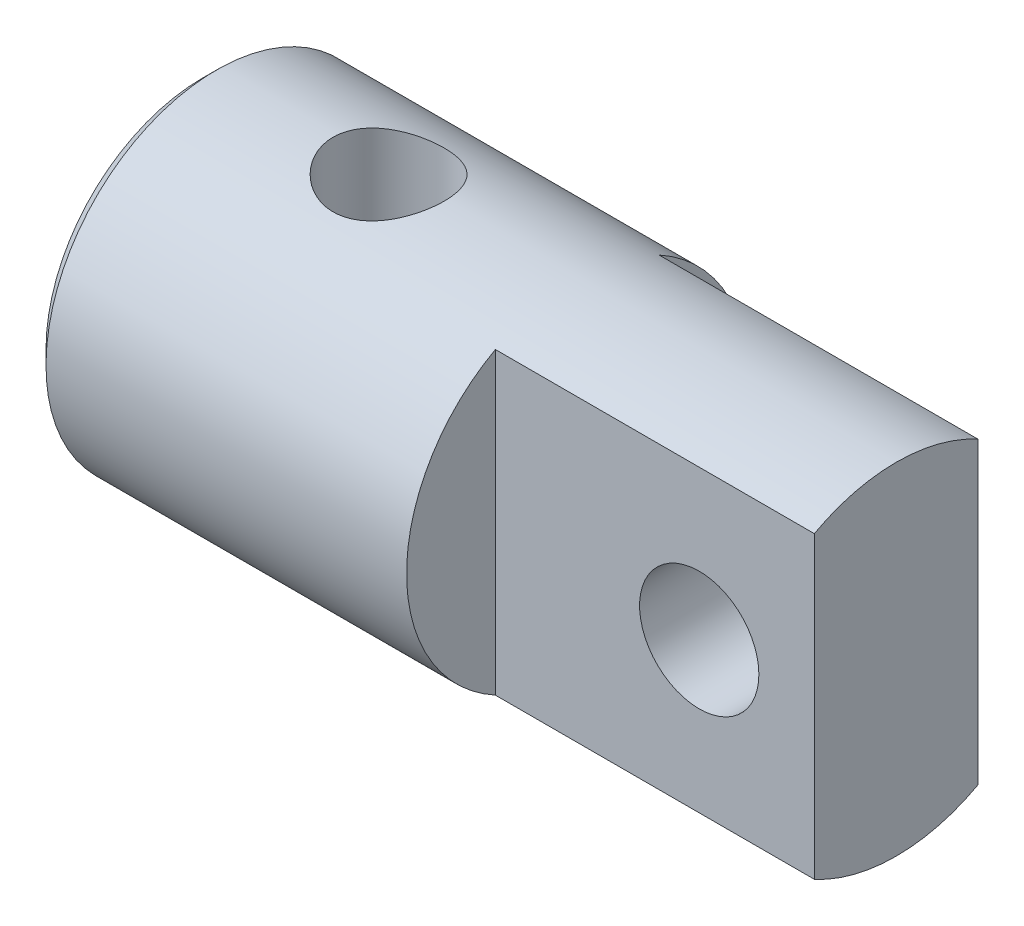
from build123d import *

# Parameters (mm, degrees)
SKETCH1_W               = 25
SKETCH1_H               = 6.15
CHAMFER1_SIZE           = 0.5
CUT_EXTRUDE1_DEPTH      = 27.469699658
CUT_EXTRUDE1_DEPTH_BACK = 27.469699658
SKETCH3_R               = 2
CUT_EXTRUDE3_DEPTH      = 27.469699799
CUT_EXTRUDE3_DEPTH_BACK = 27.469699799
SKETCH6_W               = 11.5
SKETCH6_H               = 3.2
CUT_EXTRUDE4_DEPTH      = 27.469699799
CUT_EXTRUDE4_DEPTH_BACK = 27.469699799
SKETCH11_R              = 2.15


with BuildPart() as part:
    # Sketch1 → Revolve1 (revolve)
    with BuildSketch(Plane.XY):
        with Locations((12.5, 3.075)):
            Rectangle(SKETCH1_W, SKETCH1_H)
    revolve(axis=Axis((25, 0, 0), (-1, 0, 0)))

    # Chamfer1
    chamfer1_edges = [part.edges().sort_by_distance(p)[0] for p in [
        (0, -6.15, 0),
    ]]
    chamfer(chamfer1_edges, length=CHAMFER1_SIZE)

    # Sketch3 → Cut-Extrude1 (cut, two sides: drawn at the far end of the back side and taken through both)
    with BuildSketch(Plane(origin=(0, 0, 0), x_dir=(1, 0, 0), z_dir=(0, 1, 0)).offset(-CUT_EXTRUDE1_DEPTH_BACK)):
        with Locations((6.7, 0)):
            Circle(SKETCH3_R)
    extrude(amount=CUT_EXTRUDE1_DEPTH + CUT_EXTRUDE1_DEPTH_BACK, mode=Mode.SUBTRACT)

    # Sketch6 → Cut-Extrude3 (cut, two sides: drawn at the far end of the back side and taken through both)
    with BuildSketch(Plane(origin=(0, 0, 0), x_dir=(1, 0, 0), z_dir=(0, 1, 0)).offset(-CUT_EXTRUDE3_DEPTH_BACK)):
        with Locations((19.25, -4.55)):
            Rectangle(SKETCH6_W, SKETCH6_H)
        with Locations((19.25, 4.55)):
            Rectangle(SKETCH6_W, SKETCH6_H)
    extrude(amount=CUT_EXTRUDE3_DEPTH + CUT_EXTRUDE3_DEPTH_BACK, mode=Mode.SUBTRACT)

    # Sketch11 → Cut-Extrude4 (cut, two sides: drawn at the far end of the back side and taken through both)
    with BuildSketch(Plane.XY.offset(-CUT_EXTRUDE4_DEPTH_BACK)):
        with Locations((20.85, 0)):
            Circle(SKETCH11_R)
    extrude(amount=CUT_EXTRUDE4_DEPTH + CUT_EXTRUDE4_DEPTH_BACK, mode=Mode.SUBTRACT)


solid = part.part
